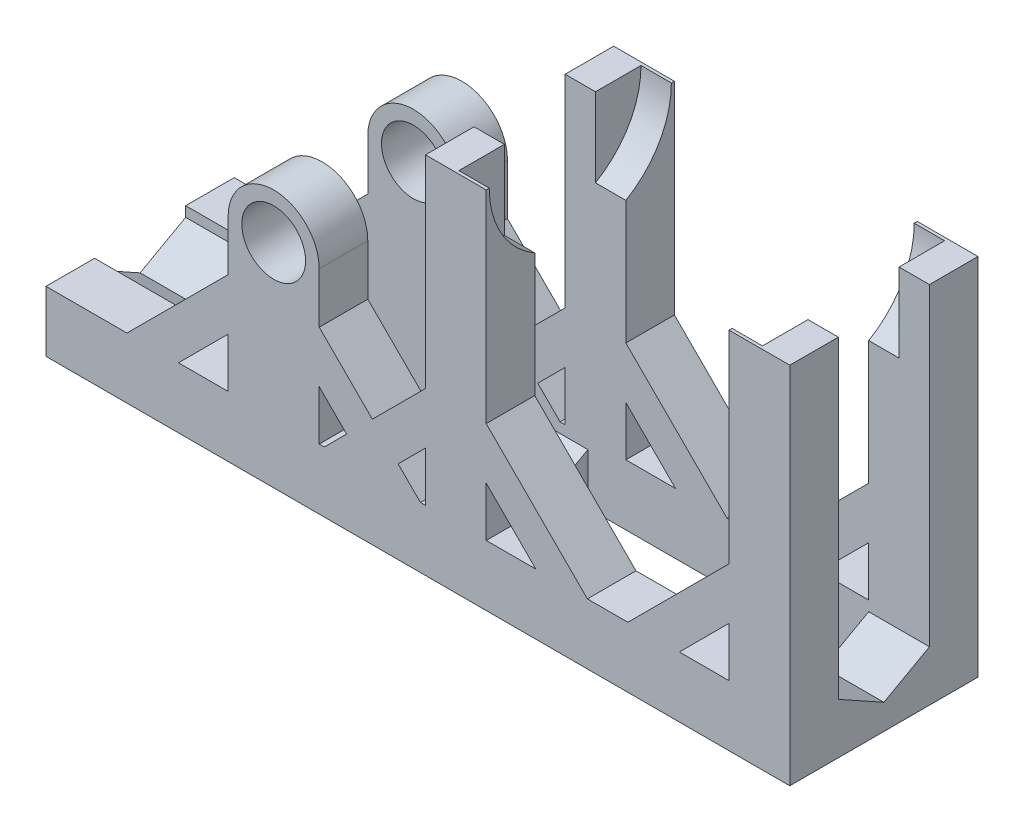
from build123d import *

# Parameters (mm, degrees)
SKETCH1_R            = 5.25
BOSS_EXTRUDE1_DEPTH  = 8
BOSS_EXTRUDE2_DEPTH  = 10
LPATTERN1_COUNT      = 3
LPATTERN1_PITCH      = 56.25
MIRROR1_COPY_1_DEPTH = 10
MIRROR1_COPY_2_DEPTH = 10
CUT_EXTRUDE1_START   = -5
SKETCH3_R            = 15
CUT_EXTRUDE1_DEPTH   = 50


with BuildPart() as part:
    # Sketch1 → Boss-Extrude1 (new body)
    with BuildSketch(Plane.XY):
        with BuildLine():
            Line((85, 0), (85, 60))
            Line((85, 60), (75, 60))
            Line((75, 60), (75, 26.666666667))
            Line((75, 26.666666667), (58.333333333, 10))
            Line((58.333333333, 10), (51.666666667, 10))
            Line((51.666666667, 10), (35, 26.666666667))
            Line((35, 26.666666667), (35, 60))
            Line((35, 60), (25, 60))
            Line((25, 60), (25, 26.666666667))
            Line((25, 26.666666667), (16.25, 17.916666667))
            Line((16.25, 17.916666667), (7.5, 26.666666667))
            Line((7.5, 26.666666667), (7.5, 35))
            ThreePointArc((7.5, 35), (0, 42.5), (-7.5, 35))
            Line((-7.5, 35), (-7.5, 26.666666667))
            Line((-7.5, 26.666666667), (-24.166666667, 10))
            Line((-24.166666667, 10), (-37.5, 10))
            Line((-37.5, 10), (-37.5, 0))
            Line((-37.5, 0), (85, 0))
        make_face()
        Polygon((12.007359313, 13.67402598), (8.333333333, 10), (7.5, 10), (7.5, 18.181385292), align=None, mode=Mode.SUBTRACT)
        with Locations((0, 35)):
            Circle(SKETCH1_R, mode=Mode.SUBTRACT)
        Polygon((24.166666667, 10), (20.492640687, 13.67402598), (25, 18.181385292), (25, 10), align=None, mode=Mode.SUBTRACT)
        Polygon((35, 10), (35, 18.181385292), (43.181385292, 10), align=None, mode=Mode.SUBTRACT)
        Polygon((75, 10), (66.818614708, 10), (75, 18.181385292), align=None, mode=Mode.SUBTRACT)
        Polygon((-7.5, 10), (-15.681385292, 10), (-7.5, 18.181385292), align=None, mode=Mode.SUBTRACT)
    boss_extrude1 = extrude(amount=BOSS_EXTRUDE1_DEPTH)

    # Sketch2 → Boss-Extrude2 (add)
    with BuildSketch(Plane(origin=(-37.5, 0, 0), x_dir=(0, 0, -1), z_dir=(1, 0, 0))):
        Polygon((7.5, 4.166666667), (0, 8.333333333), (0, 0), (7.5, 0), align=None)
    boss_extrude2 = extrude(amount=BOSS_EXTRUDE2_DEPTH)

    # LPattern1: Boss-Extrude2 ×3
    with Locations(*[(i * LPATTERN1_PITCH, 0, 0) for i in range(1, LPATTERN1_COUNT)]):
        add(boss_extrude2)

    # Mirror1: Boss-Extrude1, Boss-Extrude2 across plane
    add(boss_extrude1.mirror(Plane(origin=(-27.5, 0, -7.5), x_dir=(1, 0, 0), z_dir=(0, 0, 1))))
    add(boss_extrude2.mirror(Plane(origin=(-27.5, 0, -7.5), x_dir=(1, 0, 0), z_dir=(0, 0, 1))))

    # Mirror1 copy 1 sketch → Mirror1 copy 1 (add)
    with BuildSketch(Plane(origin=(18.75, 0, -15), x_dir=(0, 0, 1), z_dir=(1, 0, 0))):
        Polygon((7.5, -4.166666667), (0, -8.333333333), (0, 0), (7.5, 0), align=None)
    extrude(amount=MIRROR1_COPY_1_DEPTH)

    # Mirror1 copy 2 sketch → Mirror1 copy 2 (add)
    with BuildSketch(Plane(origin=(75, 0, -15), x_dir=(0, 0, 1), z_dir=(1, 0, 0))):
        Polygon((7.5, -4.166666667), (0, -8.333333333), (0, 0), (7.5, 0), align=None)
    extrude(amount=MIRROR1_COPY_2_DEPTH)

    # Sketch3 → Cut-Extrude1 (cut)
    with BuildSketch(Plane(origin=(35, 0, 0), x_dir=(0, 0, -1), z_dir=(1, 0, 0)).offset(CUT_EXTRUDE1_START)):
        with Locations((7.5, 60)):
            Circle(SKETCH3_R)
    extrude(amount=CUT_EXTRUDE1_DEPTH, mode=Mode.SUBTRACT)


solid = part.part
